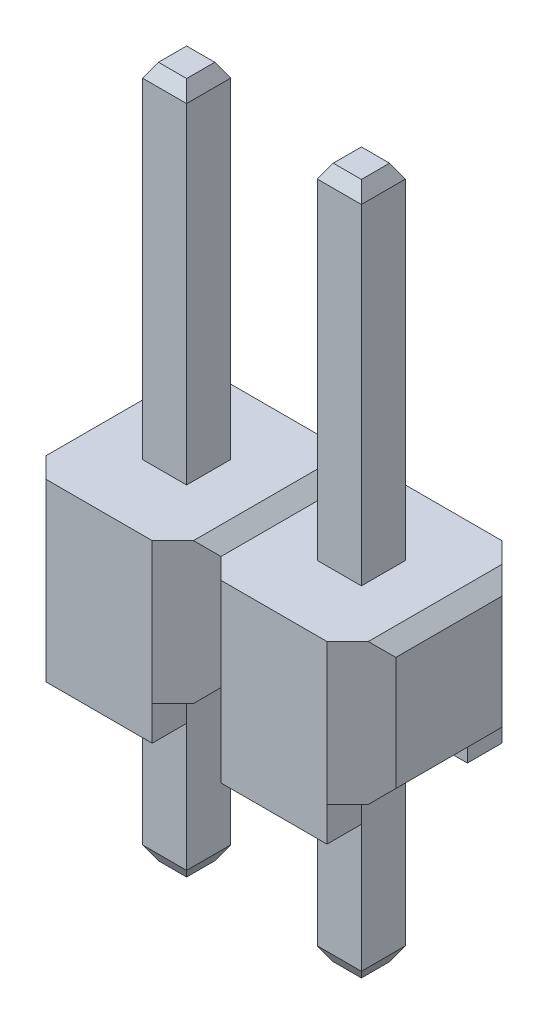
from build123d import *
from OCP.BRepFilletAPI import BRepFilletAPI_MakeChamfer

# Parameters (mm, degrees)
SKETCH1_W                = 0.64
SKETCH1_H                = 0.64
BOSS_EXTRUDE1_DEPTH      = 2.05
CUT_EXTRUDE1_DEPTH       = 5
SKETCH3_W                = 1.54
SKETCH3_H                = 0.5
BOSS_EXTRUDE2_DEPTH      = 0.5
BOSS_EXTRUDE3_DEPTH      = 5
BOSS_EXTRUDE3_DEPTH_BACK = 5.05
SKETCH4_W                = 0.64
SKETCH4_H                = 0.64
CHAMFER1_SIZE            = 0.2
CHAMFER1_SIZE2           = 0.115470054
SKETCH5_R                = 0.125
CUT_EXTRUDE2_DEPTH       = 1


with BuildPart() as part:
    # Sketch1 → Boss-Extrude1 (new body)
    with BuildSketch(Plane(origin=(0, 0, 0), x_dir=(1, 0, 0), z_dir=(0, 1, 0))):
        Polygon((-2.04, -1.27), (-0.5, -1.27), (0, -0.77), (0.5, -1.27), (2.04, -1.27), (2.54, -0.77), (2.54, 0.77), (2.04, 1.27), (0.5, 1.27), (0, 0.77), (-0.5, 1.27), (-2.04, 1.27), (-2.54, 0.77), (-2.54, -0.77), align=None)
        with Locations((1.27, 0)):
            Rectangle(SKETCH1_W, SKETCH1_H, mode=Mode.SUBTRACT)
        with Locations((-1.27, 0)):
            Rectangle(SKETCH1_W, SKETCH1_H, mode=Mode.SUBTRACT)
    extrude(amount=-BOSS_EXTRUDE1_DEPTH)

    # Sketch2 → Cut-Extrude1 (cut, symmetric)
    with BuildSketch(Plane.XY):
        Polygon((-2.54, -0.2), (-2.54, 0), (-2.34, 0), align=None)
        Polygon((-0.2, 0), (0.2, 0), (0, -0.2), align=None)
        Polygon((2.34, 0), (2.54, 0), (2.54, -0.2), align=None)
        Polygon((-2.54, -1.85), (-2.34, -2.05), (-2.54, -2.05), align=None)
        Polygon((-0.2, -2.05), (0, -1.85), (0.2, -2.05), align=None)
        Polygon((2.34, -2.05), (2.54, -1.85), (2.54, -2.05), align=None)
    extrude(amount=CUT_EXTRUDE1_DEPTH, both=True, mode=Mode.SUBTRACT)

    # Sketch3 → Boss-Extrude2 (add)
    with BuildSketch(Plane.XZ.offset(2.05)):
        with Locations((-1.27, -1.02)):
            Rectangle(SKETCH3_W, SKETCH3_H)
        with Locations((-1.27, 1.02)):
            Rectangle(SKETCH3_W, SKETCH3_H)
        with Locations((1.27, 1.02)):
            Rectangle(SKETCH3_W, SKETCH3_H)
        with Locations((1.27, -1.02)):
            Rectangle(SKETCH3_W, SKETCH3_H)
    extrude(amount=BOSS_EXTRUDE2_DEPTH)

    # Sketch4 → Boss-Extrude3 (add, two sides: drawn at the far end of the back side and taken through both)
    with BuildSketch(Plane(origin=(0, 0, 0), x_dir=(1, 0, 0), z_dir=(0, 1, 0)).offset(-BOSS_EXTRUDE3_DEPTH_BACK)):
        with Locations((-1.27, 0)):
            Rectangle(SKETCH4_W, SKETCH4_H)
        with Locations((1.27, 0)):
            Rectangle(SKETCH4_W, SKETCH4_H)
    extrude(amount=BOSS_EXTRUDE3_DEPTH + BOSS_EXTRUDE3_DEPTH_BACK)

    # Chamfer1: one chamfer whose edges measure the first distance from different faces: ONE call of the kernel's chamfer builder (chamfer() names one face for all edges)
    chamfer1_edges_1 = [part.edges().sort_by_distance(p)[0] for p in [
        (-1.59, -5.05, 0),
    ]]
    chamfer1_side_1 = [part.faces().sort_by_distance(p)[0] for p in [
        (-1.59, -3.55, 0),
    ]]
    chamfer1_edges_2 = [part.edges().sort_by_distance(p)[0] for p in [
        (-1.27, -5.05, -0.32),
    ]]
    chamfer1_side_2 = [part.faces().sort_by_distance(p)[0] for p in [
        (-1.27, -3.55, -0.32),
    ]]
    chamfer1_edges_3 = [part.edges().sort_by_distance(p)[0] for p in [
        (-0.95, -5.05, 0),
    ]]
    chamfer1_side_3 = [part.faces().sort_by_distance(p)[0] for p in [
        (-0.95, -3.55, 0),
    ]]
    chamfer1_edges_4 = [part.edges().sort_by_distance(p)[0] for p in [
        (-1.27, -5.05, 0.32),
    ]]
    chamfer1_side_4 = [part.faces().sort_by_distance(p)[0] for p in [
        (-1.27, -3.55, 0.32),
    ]]
    chamfer1_edges_5 = [part.edges().sort_by_distance(p)[0] for p in [
        (-1.59, 5, 0),
    ]]
    chamfer1_side_5 = [part.faces().sort_by_distance(p)[0] for p in [
        (-1.59, 2.5, 0),
    ]]
    chamfer1_edges_6 = [part.edges().sort_by_distance(p)[0] for p in [
        (-1.27, 5, 0.32),
    ]]
    chamfer1_side_6 = [part.faces().sort_by_distance(p)[0] for p in [
        (-1.27, 2.5, 0.32),
    ]]
    chamfer1_edges_7 = [part.edges().sort_by_distance(p)[0] for p in [
        (-0.95, 5, 0),
    ]]
    chamfer1_side_7 = [part.faces().sort_by_distance(p)[0] for p in [
        (-0.95, 2.5, 0),
    ]]
    chamfer1_edges_8 = [part.edges().sort_by_distance(p)[0] for p in [
        (-1.27, 5, -0.32),
    ]]
    chamfer1_side_8 = [part.faces().sort_by_distance(p)[0] for p in [
        (-1.27, 2.5, -0.32),
    ]]
    chamfer1_edges_9 = [part.edges().sort_by_distance(p)[0] for p in [
        (0.95, -5.05, 0),
    ]]
    chamfer1_side_9 = [part.faces().sort_by_distance(p)[0] for p in [
        (0.95, -3.55, 0),
    ]]
    chamfer1_edges_10 = [part.edges().sort_by_distance(p)[0] for p in [
        (1.27, -5.05, -0.32),
    ]]
    chamfer1_side_10 = [part.faces().sort_by_distance(p)[0] for p in [
        (1.27, -3.55, -0.32),
    ]]
    chamfer1_edges_11 = [part.edges().sort_by_distance(p)[0] for p in [
        (1.59, -5.05, 0),
    ]]
    chamfer1_side_11 = [part.faces().sort_by_distance(p)[0] for p in [
        (1.59, -3.55, 0),
    ]]
    chamfer1_edges_12 = [part.edges().sort_by_distance(p)[0] for p in [
        (1.27, -5.05, 0.32),
    ]]
    chamfer1_side_12 = [part.faces().sort_by_distance(p)[0] for p in [
        (1.27, -3.55, 0.32),
    ]]
    chamfer1_edges_13 = [part.edges().sort_by_distance(p)[0] for p in [
        (0.95, 5, 0),
    ]]
    chamfer1_side_13 = [part.faces().sort_by_distance(p)[0] for p in [
        (0.95, 2.5, 0),
    ]]
    chamfer1_edges_14 = [part.edges().sort_by_distance(p)[0] for p in [
        (1.27, 5, 0.32),
    ]]
    chamfer1_side_14 = [part.faces().sort_by_distance(p)[0] for p in [
        (1.27, 2.5, 0.32),
    ]]
    chamfer1_edges_15 = [part.edges().sort_by_distance(p)[0] for p in [
        (1.59, 5, 0),
    ]]
    chamfer1_side_15 = [part.faces().sort_by_distance(p)[0] for p in [
        (1.59, 2.5, 0),
    ]]
    chamfer1_edges_16 = [part.edges().sort_by_distance(p)[0] for p in [
        (1.27, 5, -0.32),
    ]]
    chamfer1_side_16 = [part.faces().sort_by_distance(p)[0] for p in [
        (1.27, 2.5, -0.32),
    ]]
    chamfer1 = BRepFilletAPI_MakeChamfer(part.part.solid().wrapped)
    for e in chamfer1_edges_1:
        chamfer1.Add(CHAMFER1_SIZE, CHAMFER1_SIZE2, e.wrapped, chamfer1_side_1[0].wrapped)  # the first distance lies on this face
    for e in chamfer1_edges_2:
        chamfer1.Add(CHAMFER1_SIZE, CHAMFER1_SIZE2, e.wrapped, chamfer1_side_2[0].wrapped)  # the first distance lies on this face
    for e in chamfer1_edges_3:
        chamfer1.Add(CHAMFER1_SIZE, CHAMFER1_SIZE2, e.wrapped, chamfer1_side_3[0].wrapped)  # the first distance lies on this face
    for e in chamfer1_edges_4:
        chamfer1.Add(CHAMFER1_SIZE, CHAMFER1_SIZE2, e.wrapped, chamfer1_side_4[0].wrapped)  # the first distance lies on this face
    for e in chamfer1_edges_5:
        chamfer1.Add(CHAMFER1_SIZE, CHAMFER1_SIZE2, e.wrapped, chamfer1_side_5[0].wrapped)  # the first distance lies on this face
    for e in chamfer1_edges_6:
        chamfer1.Add(CHAMFER1_SIZE, CHAMFER1_SIZE2, e.wrapped, chamfer1_side_6[0].wrapped)  # the first distance lies on this face
    for e in chamfer1_edges_7:
        chamfer1.Add(CHAMFER1_SIZE, CHAMFER1_SIZE2, e.wrapped, chamfer1_side_7[0].wrapped)  # the first distance lies on this face
    for e in chamfer1_edges_8:
        chamfer1.Add(CHAMFER1_SIZE, CHAMFER1_SIZE2, e.wrapped, chamfer1_side_8[0].wrapped)  # the first distance lies on this face
    for e in chamfer1_edges_9:
        chamfer1.Add(CHAMFER1_SIZE, CHAMFER1_SIZE2, e.wrapped, chamfer1_side_9[0].wrapped)  # the first distance lies on this face
    for e in chamfer1_edges_10:
        chamfer1.Add(CHAMFER1_SIZE, CHAMFER1_SIZE2, e.wrapped, chamfer1_side_10[0].wrapped)  # the first distance lies on this face
    for e in chamfer1_edges_11:
        chamfer1.Add(CHAMFER1_SIZE, CHAMFER1_SIZE2, e.wrapped, chamfer1_side_11[0].wrapped)  # the first distance lies on this face
    for e in chamfer1_edges_12:
        chamfer1.Add(CHAMFER1_SIZE, CHAMFER1_SIZE2, e.wrapped, chamfer1_side_12[0].wrapped)  # the first distance lies on this face
    for e in chamfer1_edges_13:
        chamfer1.Add(CHAMFER1_SIZE, CHAMFER1_SIZE2, e.wrapped, chamfer1_side_13[0].wrapped)  # the first distance lies on this face
    for e in chamfer1_edges_14:
        chamfer1.Add(CHAMFER1_SIZE, CHAMFER1_SIZE2, e.wrapped, chamfer1_side_14[0].wrapped)  # the first distance lies on this face
    for e in chamfer1_edges_15:
        chamfer1.Add(CHAMFER1_SIZE, CHAMFER1_SIZE2, e.wrapped, chamfer1_side_15[0].wrapped)  # the first distance lies on this face
    for e in chamfer1_edges_16:
        chamfer1.Add(CHAMFER1_SIZE, CHAMFER1_SIZE2, e.wrapped, chamfer1_side_16[0].wrapped)  # the first distance lies on this face
    add(Compound.cast(chamfer1.Shape()), mode=Mode.REPLACE)

    # Sketch5 → Cut-Extrude2 (cut)
    with BuildSketch(Plane.XZ.offset(5.05)):
        with Locations(Location((-1.27, 0, 0), (0, 0, 270))):
            Circle(SKETCH5_R)
    extrude(amount=-CUT_EXTRUDE2_DEPTH, mode=Mode.SUBTRACT)


solid = part.part
